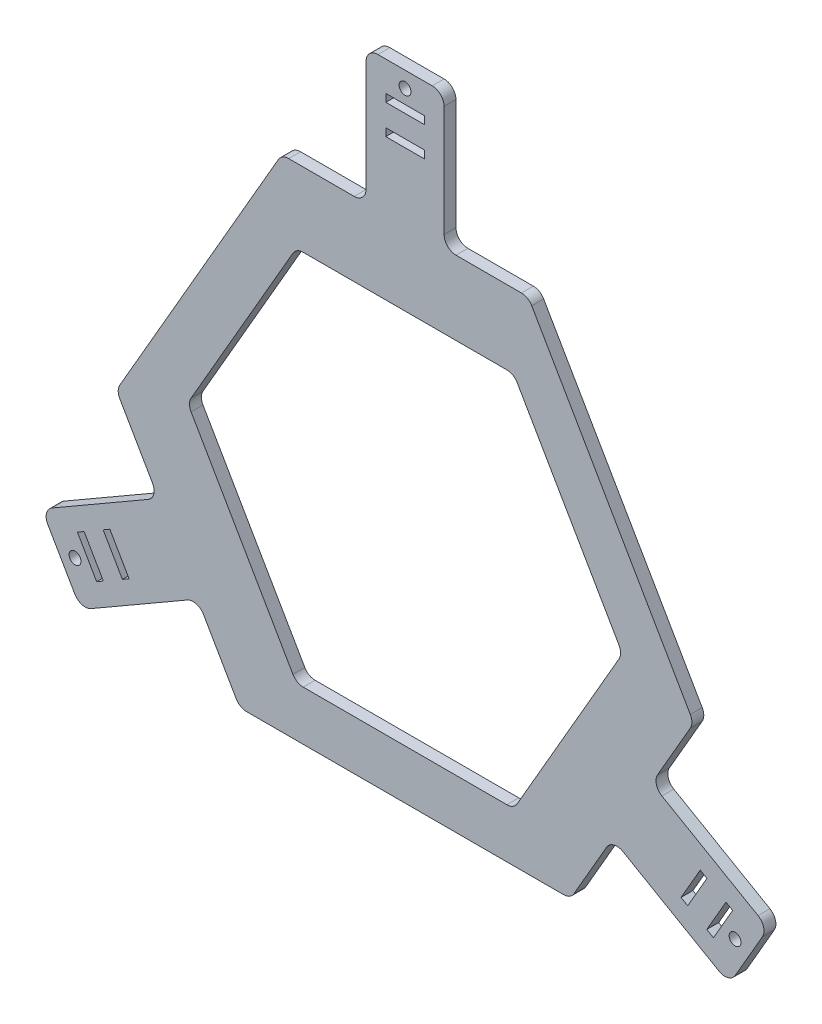
from build123d import *

# Parameters (mm, degrees)
SKETCH_1_R          = 1.5
SKETCH_1_W          = 9.7
SKETCH_1_H          = 1.95
EXTRUDE_3_DEPTH     = 3
CUT_EXTRUDE_1_DEPTH = 10


with BuildPart() as part:
    # Эскиз1 → Бобышка-Вытянуть3 (new body)
    with BuildSketch(Plane.XY):
        with BuildLine():
            Line((-88.837912602, -46.410254038), (-84.611415294, -53.730762114))
            Line((-84.611415294, -53.730762114), (-83.299663948, -56.002782092))
            ThreePointArc((-83.299663948, -56.002782092), (-81.478044872, -57.40055957), (-79.201587737, -57.100858303))
            Line((-79.201587737, -57.100858303), (-54.952876431, -43.100858303))
            ThreePointArc((-54.952876431, -43.100858303), (-52.676419295, -42.801157035), (-50.854800219, -44.198934514))
            Line((-50.854800219, -44.198934514), (-42.598076211, -58.5))
            ThreePointArc((-42.598076211, -58.5), (-41.5, -59.598076211), (-40, -60))
            Line((-40, -60), (40, -60))
            ThreePointArc((40, -60), (41.5, -59.598076211), (42.598076211, -58.5))
            Line((42.598076211, -58.5), (50.854800219, -44.198934514))
            ThreePointArc((50.854800219, -44.198934514), (52.676419295, -42.801157035), (54.952876431, -43.100858303))
            Line((54.952876431, -43.100858303), (79.201587737, -57.100858303))
            ThreePointArc((79.201587737, -57.100858303), (81.478044872, -57.40055957), (83.299663948, -56.002782092))
            Line((83.299663948, -56.002782092), (84.611415294, -53.730762114))
            Line((84.611415294, -53.730762114), (88.837912602, -46.410254038))
            Line((88.837912602, -46.410254038), (90.149663948, -44.13823406))
            ThreePointArc((90.149663948, -44.13823406), (90.449365215, -41.861776924), (89.051587737, -40.040157848))
            Line((89.051587737, -40.040157848), (64.802876431, -26.040157848))
            ThreePointArc((64.802876431, -26.040157848), (63.405098952, -24.218538772), (63.704800219, -21.942081637))
            Line((63.704800219, -21.942081637), (71.961524227, -7.641016151))
            ThreePointArc((71.961524227, -7.641016151), (72.363448016, -6.141016151), (71.961524227, -4.641016151))
            Line((71.961524227, -4.641016151), (31.961524227, 64.641016151))
            ThreePointArc((31.961524227, 64.641016151), (30.863448016, 65.739092363), (29.363448016, 66.141016151))
            Line((29.363448016, 66.141016151), (12.85, 66.141016151))
            ThreePointArc((12.85, 66.141016151), (10.728679656, 67.019695808), (9.85, 69.141016151))
            Line((9.85, 69.141016151), (9.85, 97.141016151))
            ThreePointArc((9.85, 97.141016151), (8.971320344, 99.262336495), (6.85, 100.141016151))
            Line((6.85, 100.141016151), (4.226497308, 100.141016151))
            Line((4.226497308, 100.141016151), (-4.226497308, 100.141016151))
            Line((-4.226497308, 100.141016151), (-6.85, 100.141016151))
            ThreePointArc((-6.85, 100.141016151), (-8.971320344, 99.262336495), (-9.85, 97.141016151))
            Line((-9.85, 97.141016151), (-9.85, 69.141016151))
            ThreePointArc((-9.85, 69.141016151), (-10.728679656, 67.019695808), (-12.85, 66.141016151))
            Line((-12.85, 66.141016151), (-29.363448016, 66.141016151))
            ThreePointArc((-29.363448016, 66.141016151), (-30.863448016, 65.739092363), (-31.961524227, 64.641016151))
            Line((-31.961524227, 64.641016151), (-71.961524227, -4.641016151))
            ThreePointArc((-71.961524227, -4.641016151), (-72.363448016, -6.141016151), (-71.961524227, -7.641016151))
            Line((-71.961524227, -7.641016151), (-63.704800219, -21.942081637))
            ThreePointArc((-63.704800219, -21.942081637), (-63.405098952, -24.218538772), (-64.802876431, -26.040157848))
            Line((-64.802876431, -26.040157848), (-89.051587737, -40.040157848))
            ThreePointArc((-89.051587737, -40.040157848), (-90.449365215, -41.861776924), (-90.149663948, -44.13823406))
            Line((-90.149663948, -44.13823406), (-88.837912602, -46.410254038))
        make_face()
        with Locations((-83.260562333, -48.070508076)):
            Circle(SKETCH_1_R, mode=Mode.SUBTRACT)
        with Locations(Location((83.260562333, -48.070508076, 0), (0, 0, 180))):
            Circle(SKETCH_1_R, mode=Mode.SUBTRACT)
        with Locations((0, 96.141016151)):
            Circle(SKETCH_1_R, mode=Mode.SUBTRACT)
        Polygon((-77.804473419, -50.520731284), (-82.654473419, -42.120284867), (-80.965723882, -41.145284867), (-76.115723882, -49.545731284), align=None, mode=Mode.SUBTRACT)
        Polygon((-71.309282891, -46.770731284), (-76.159282891, -38.370284867), (-74.470533354, -37.395284867), (-69.620533354, -45.795731284), align=None, mode=Mode.SUBTRACT)
        Polygon((69.620533354, -45.795731284), (74.470533354, -37.395284867), (76.159282891, -38.370284867), (71.309282891, -46.770731284), align=None, mode=Mode.SUBTRACT)
        Polygon((76.115723882, -49.545731284), (80.965723882, -41.145284867), (82.654473419, -42.120284867), (77.804473419, -50.520731284), align=None, mode=Mode.SUBTRACT)
        with Locations((0, 91.666016151)):
            Rectangle(SKETCH_1_W, SKETCH_1_H, mode=Mode.SUBTRACT)
        with Locations((0, 84.166016151)):
            Rectangle(SKETCH_1_W, SKETCH_1_H, mode=Mode.SUBTRACT)
    extrude(amount=EXTRUDE_3_DEPTH)

    # Эскиз2 → Вырез-Вытянуть1 (cut)
    with BuildSketch(Plane.XY.offset(3)):
        with BuildLine():
            Line((28.29016319, -46), (53.982250169, -1.5))
            ThreePointArc((53.982250169, -1.5), (54.384173958, 0), (53.982250169, 1.5))
            Line((53.982250169, 1.5), (28.29016319, 46))
            ThreePointArc((28.29016319, 46), (27.192086979, 47.098076211), (25.692086979, 47.5))
            Line((25.692086979, 47.5), (-25.692086979, 47.5))
            ThreePointArc((-25.692086979, 47.5), (-27.192086979, 47.098076211), (-28.29016319, 46))
            Line((-28.29016319, 46), (-53.982250169, 1.5))
            ThreePointArc((-53.982250169, 1.5), (-54.384173958, 0), (-53.982250169, -1.5))
            Line((-53.982250169, -1.5), (-28.29016319, -46))
            ThreePointArc((-28.29016319, -46), (-27.192086979, -47.098076211), (-25.692086979, -47.5))
            Line((-25.692086979, -47.5), (25.692086979, -47.5))
            ThreePointArc((25.692086979, -47.5), (27.192086979, -47.098076211), (28.29016319, -46))
        make_face()
    extrude(amount=-CUT_EXTRUDE_1_DEPTH, mode=Mode.SUBTRACT)


solid = part.part
